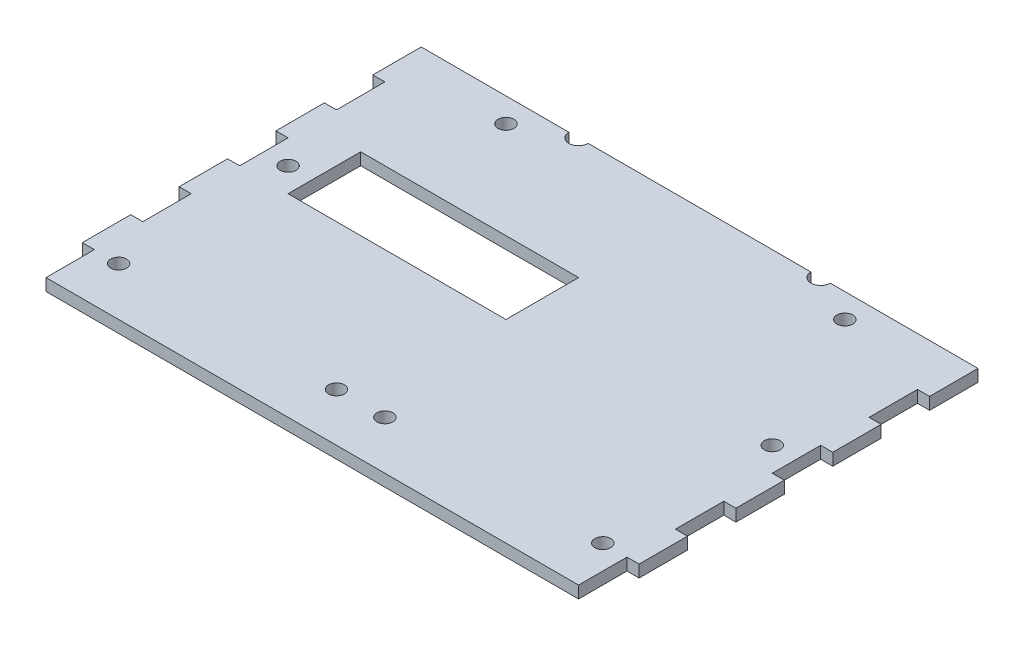
from build123d import *

# Parameters (mm, degrees)
SKETCH2_R           = 2.0828
SKETCH2_W           = 57.15
SKETCH2_H           = 19.05
BOSS_EXTRUDE1_DEPTH = 3.175


with BuildPart() as part:
    # Sketch2 → Boss-Extrude1 (new body)
    with BuildSketch(Plane(origin=(0, 0, 0), x_dir=(1, 0, 0), z_dir=(0, 1, 0))):
        with BuildLine():
            Line((3.175, 0), (3.175, 12.7))
            Line((3.175, 12.7), (0, 12.7))
            Line((0, 12.7), (0, 25.4))
            Line((0, 25.4), (3.175, 25.4))
            Line((3.175, 25.4), (3.175, 38.1))
            Line((3.175, 38.1), (0, 38.1))
            Line((0, 38.1), (0, 50.8))
            Line((0, 50.8), (3.175, 50.8))
            Line((3.175, 50.8), (3.175, 63.5))
            Line((3.175, 63.5), (0, 63.5))
            Line((0, 63.5), (0, 76.2))
            Line((0, 76.2), (3.175, 76.2))
            Line((3.175, 76.2), (3.175, 88.9))
            Line((3.175, 88.9), (0, 88.9))
            Line((0, 88.9), (0, 101.6))
            Line((0, 101.6), (3.175, 101.6))
            Line((3.175, 101.6), (38.735, 101.6))
            ThreePointArc((38.735, 101.6), (41.275, 99.06), (43.815, 101.6))
            Line((43.815, 101.6), (102.235, 101.6))
            ThreePointArc((102.235, 101.6), (104.775, 99.06), (107.315, 101.6))
            Line((107.315, 101.6), (142.875, 101.6))
            Line((142.875, 101.6), (146.05, 101.6))
            Line((146.05, 101.6), (146.05, 88.9))
            Line((146.05, 88.9), (142.875, 88.9))
            Line((142.875, 88.9), (142.875, 76.2))
            Line((142.875, 76.2), (146.05, 76.2))
            Line((146.05, 76.2), (146.05, 63.5))
            Line((146.05, 63.5), (142.875, 63.5))
            Line((142.875, 63.5), (142.875, 50.8))
            Line((142.875, 50.8), (146.05, 50.8))
            Line((146.05, 50.8), (146.05, 38.1))
            Line((146.05, 38.1), (142.875, 38.1))
            Line((142.875, 38.1), (142.875, 25.4))
            Line((142.875, 25.4), (146.05, 25.4))
            Line((146.05, 25.4), (146.05, 12.7))
            Line((146.05, 12.7), (142.875, 12.7))
            Line((142.875, 12.7), (142.875, 0))
            Line((142.875, 0), (3.175, 0))
        make_face()
        with Locations(Location((136.525, 57.15, 0), (0, 0, 90))):
            Circle(SKETCH2_R, mode=Mode.SUBTRACT)
        with Locations(Location((9.525, 12.7, 0), (0, 0, 270))):
            Circle(SKETCH2_R, mode=Mode.SUBTRACT)
        with Locations(Location((9.525, 57.15, 0), (0, 0, 270))):
            Circle(SKETCH2_R, mode=Mode.SUBTRACT)
        with Locations(Location((136.525, 12.7, 0), (0, 0, 90))):
            Circle(SKETCH2_R, mode=Mode.SUBTRACT)
        with Locations(Location((28.575, 95.25, 0), (0, 0, 270))):
            Circle(SKETCH2_R, mode=Mode.SUBTRACT)
        with Locations(Location((117.475, 95.25, 0), (0, 0, 90))):
            Circle(SKETCH2_R, mode=Mode.SUBTRACT)
        with Locations(Location((66.675, 12.7, 0), (0, 0, 270))):
            Circle(SKETCH2_R, mode=Mode.SUBTRACT)
        with Locations(Location((79.375, 12.7, 0), (0, 0, 90))):
            Circle(SKETCH2_R, mode=Mode.SUBTRACT)
        with Locations((44.45, 60.325)):
            Rectangle(SKETCH2_W, SKETCH2_H, mode=Mode.SUBTRACT)
    extrude(amount=BOSS_EXTRUDE1_DEPTH)


solid = part.part
